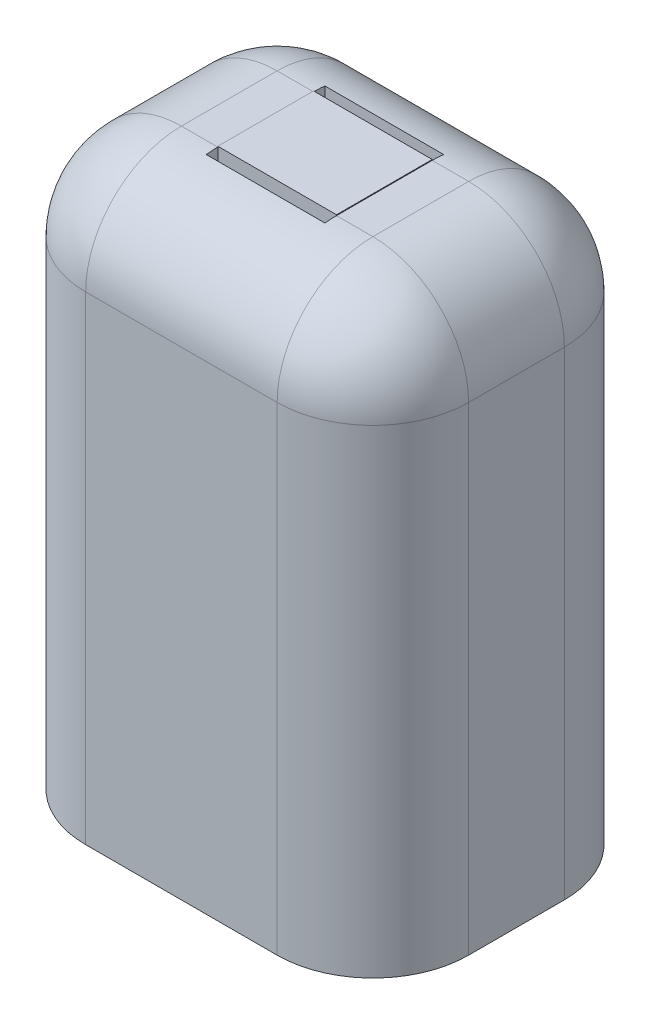
from build123d import *

# Parameters (mm, degrees)
SKETCH1_W           = 20
SKETCH1_H           = 30
BOSS_EXTRUDE1_DEPTH = 15
SKETCH2_W           = 6.2
SKETCH2_H           = 6.2
CUT_EXTRUDE1_DEPTH  = 3.25
FILLET1_R           = 5
SKETCH4_W           = 6.2
SKETCH4_H           = 6.2
CUT_EXTRUDE2_DEPTH  = 68
SKETCH6_W           = 5
SKETCH6_H           = 1
BOSS_EXTRUDE3_DEPTH = 6.2


with BuildPart() as part:
    # Sketch1 → Boss-Extrude1 (new body)
    with BuildSketch(Plane.XY):
        with Locations((-36.265495527, 120.408164147)):
            Rectangle(SKETCH1_W, SKETCH1_H)
    extrude(amount=BOSS_EXTRUDE1_DEPTH)

    # Sketch2 → Cut-Extrude1 (cut)
    with BuildSketch(Plane(origin=(0, 105.408164147, 0), x_dir=(-1, 0, 0), z_dir=(0, -1, 0))):
        with Locations((36.265495527, -7.5)):
            Rectangle(SKETCH2_W, SKETCH2_H)
    extrude(amount=-CUT_EXTRUDE1_DEPTH, mode=Mode.SUBTRACT)

    # Fillet1
    fillet1_edges = [part.edges().sort_by_distance(p)[0] for p in [
        (-46.265495527, 120.408164147, 15),
        (-26.265495527, 120.408164147, 15),
        (-46.265495527, 120.408164147, 0),
        (-36.265495527, 135.408164147, 0),
        (-26.265495527, 120.408164147, 0),
        (-36.265495527, 135.408164147, 15),
        (-46.265495527, 135.408164147, 7.5),
        (-26.265495527, 135.408164147, 7.5),
    ]]
    fillet(fillet1_edges, radius=FILLET1_R)

    # Sketch4 → Cut-Extrude2 (cut)
    with BuildSketch(Plane.XZ.offset(-108.658164147)):
        with Locations((-36.265495527, 7.5)):
            Rectangle(SKETCH4_W, SKETCH4_H)
    extrude(amount=-CUT_EXTRUDE2_DEPTH, mode=Mode.SUBTRACT)

    # Sketch6 → Boss-Extrude3 (add)
    with BuildSketch(Plane(origin=(-39.365495527, 0, 0), x_dir=(0, 0, -1), z_dir=(1, 0, 0))):
        with Locations((-7.5, 134.949726458)):
            Rectangle(SKETCH6_W, SKETCH6_H)
    extrude(amount=BOSS_EXTRUDE3_DEPTH)


solid = part.part
